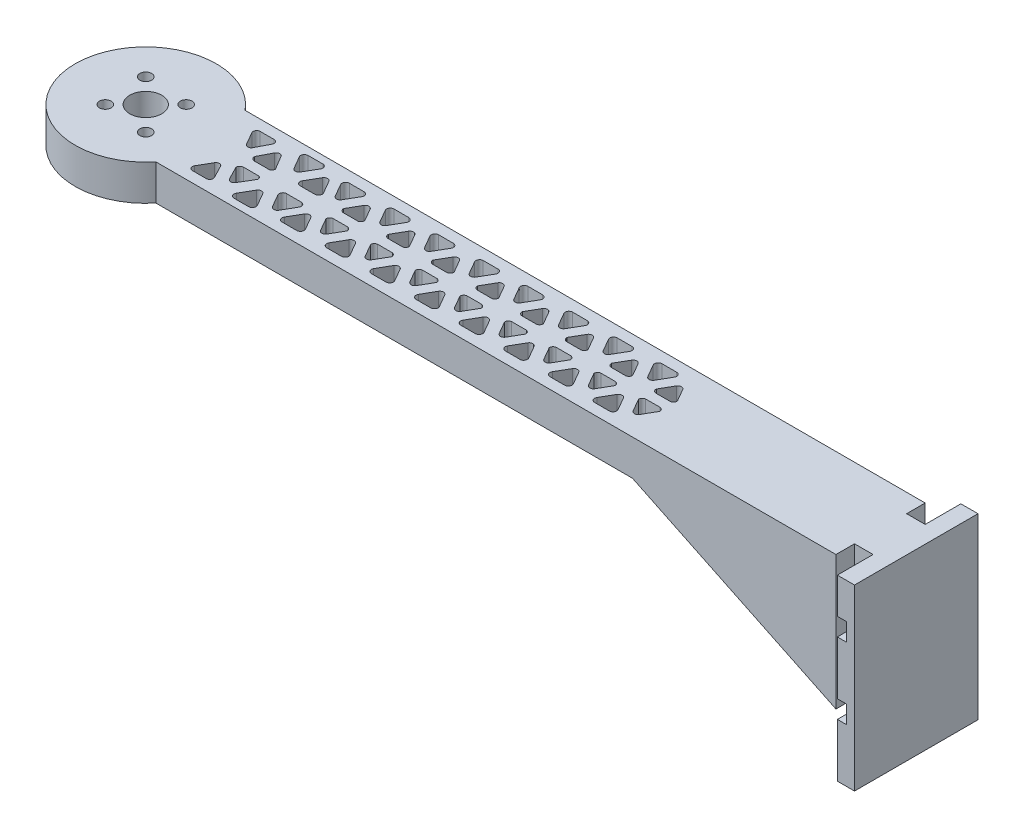
from build123d import *

# Parameters (mm, degrees)
SKETCH1_R           = 1.65
SKETCH1_R_2         = 4.5
BOSS_EXTRUDE1_DEPTH = 10
BOSS_EXTRUDE2_DEPTH = 50
BOSS_EXTRUDE3_DEPTH = 25
CUT_EXTRUDE1_REACH  = 224.387
SKETCH2_4_W         = 5.2
SKETCH2_4_H         = 5.2
CUT_EXTRUDE2_REACH  = 224.568
SKETCH4_W           = 2.5
SKETCH4_H           = 5
SKETCH4_W_2         = 0.1


with BuildPart() as part:
    # Sketch1 → Boss-Extrude1 (new body)
    with BuildSketch(Plane(origin=(0, 0, 0), x_dir=(1, 0, 0), z_dir=(0, 1, 0))):
        with BuildLine():
            Line((215.781228136, 12.419661208), (15.251683783, 12.419661208))
            ThreePointArc((15.251683783, 12.419661208), (-19.862171776, -0.080338792), (15.251683783, -12.580338792))
            Line((15.251683783, -12.580338792), (215.781228136, -12.580338792))
            Line((215.781228136, -12.580338792), (215.781228136, 12.419661208))
        make_face()
        with BuildLine():
            ThreePointArc((40.028484267, -8.923117966), (40.028697604, -9.947176998), (39.141872006, -10.459268109))
            Line((39.141872006, -10.459268109), (35.007344818, -10.459268109))
            ThreePointArc((35.007344818, -10.459268109), (34.12051922, -9.947176998), (34.120732557, -8.923117966))
            Line((34.120732557, -8.923117966), (36.187996151, -5.34480815))
            ThreePointArc((36.187996151, -5.34480815), (37.074608412, -4.833086491), (37.961220673, -5.34480815))
            Line((37.961220673, -5.34480815), (40.028484267, -8.923117966))
        make_face(mode=Mode.SUBTRACT)
        with BuildLine():
            Line((21.614703637, -8.12452744), (23.681967231, -4.546217624))
            ThreePointArc((23.681967231, -4.546217624), (24.543612682, -4.061494427), (25.383043849, -4.583744154))
            Line((25.383043849, -4.583744154), (27.244871966, -8.162053969))
            ThreePointArc((27.244871966, -8.162053969), (27.213581729, -9.113447541), (26.384038862, -9.580338792))
            Line((26.384038862, -9.580338792), (22.454947151, -9.580338792))
            ThreePointArc((22.454947151, -9.580338792), (21.614501458, -9.095029425), (21.614703637, -8.12452744))
        make_face(mode=Mode.SUBTRACT)
        with BuildLine():
            ThreePointArc((27.803132488, -2.735420106), (28.041756396, -1.959117555), (28.760166912, -1.580338792))
            Line((28.760166912, -1.580338792), (33.170984506, -1.580338792))
            ThreePointArc((33.170984506, -1.580338792), (33.622927159, -1.975727629), (33.775469807, -2.556516089))
            Line((33.775469807, -2.556516089), (31.573625479, -6.255367121))
            ThreePointArc((31.573625479, -6.255367121), (30.697555502, -6.931576396), (29.718236674, -6.416122982))
            Line((29.718236674, -6.416122982), (27.803132488, -2.735420106))
        make_face(mode=Mode.SUBTRACT)
        with BuildLine():
            Line((46.634703637, -7.963849857), (48.701967231, -4.385540041))
            ThreePointArc((48.701967231, -4.385540041), (49.588579492, -3.873818381), (50.475191753, -4.385540041))
            Line((50.475191753, -4.385540041), (52.542455347, -7.963849857))
            ThreePointArc((52.542455347, -7.963849857), (52.542668684, -8.987908889), (51.655843086, -9.5))
            Line((51.655843086, -9.5), (47.521315898, -9.5))
            ThreePointArc((47.521315898, -9.5), (46.6344903, -8.987908889), (46.634703637, -7.963849857))
        make_face(mode=Mode.SUBTRACT)
        with BuildLine():
            Line((59.144703637, -7.963849857), (61.211967231, -4.385540041))
            ThreePointArc((61.211967231, -4.385540041), (62.098579492, -3.873818381), (62.985191753, -4.385540041))
            Line((62.985191753, -4.385540041), (65.052455347, -7.963849857))
            ThreePointArc((65.052455347, -7.963849857), (65.052668684, -8.987908889), (64.165843086, -9.5))
            Line((64.165843086, -9.5), (60.031315898, -9.5))
            ThreePointArc((60.031315898, -9.5), (59.1444903, -8.987908889), (59.144703637, -7.963849857))
        make_face(mode=Mode.SUBTRACT)
        with BuildLine():
            Line((71.654703637, -7.963849857), (73.721967231, -4.385540041))
            ThreePointArc((73.721967231, -4.385540041), (74.608579492, -3.873818381), (75.495191753, -4.385540041))
            Line((75.495191753, -4.385540041), (77.562455347, -7.963849857))
            ThreePointArc((77.562455347, -7.963849857), (77.562668684, -8.987908889), (76.675843086, -9.5))
            Line((76.675843086, -9.5), (72.541315898, -9.5))
            ThreePointArc((72.541315898, -9.5), (71.6544903, -8.987908889), (71.654703637, -7.963849857))
        make_face(mode=Mode.SUBTRACT)
        with BuildLine():
            Line((84.164703637, -7.963849857), (86.231967231, -4.385540041))
            ThreePointArc((86.231967231, -4.385540041), (87.118579492, -3.873818381), (88.005191753, -4.385540041))
            Line((88.005191753, -4.385540041), (90.072455347, -7.963849857))
            ThreePointArc((90.072455347, -7.963849857), (90.072668684, -8.987908889), (89.185843086, -9.5))
            Line((89.185843086, -9.5), (85.051315898, -9.5))
            ThreePointArc((85.051315898, -9.5), (84.1644903, -8.987908889), (84.164703637, -7.963849857))
        make_face(mode=Mode.SUBTRACT)
        with BuildLine():
            Line((46.281498727, -3.523632181), (44.214235133, -7.101941997))
            ThreePointArc((44.214235133, -7.101941997), (43.327622872, -7.613663657), (42.441010611, -7.101941997))
            Line((42.441010611, -7.101941997), (40.373261673, -3.514943175))
            ThreePointArc((40.373261673, -3.514943175), (40.373776477, -2.491304726), (41.260359278, -1.979634055))
            Line((41.260359278, -1.979634055), (45.394886466, -1.979634055))
            ThreePointArc((45.394886466, -1.979634055), (46.287424275, -2.493670166), (46.281498727, -3.523632181))
        make_face(mode=Mode.SUBTRACT)
        with BuildLine():
            ThreePointArc((52.887718097, -2.564364072), (53.123716588, -1.859495358), (53.774330358, -1.5))
            Line((53.774330358, -1.5), (57.908857546, -1.5))
            ThreePointArc((57.908857546, -1.5), (58.556731527, -1.85658781), (58.795469807, -2.556516089))
            Line((58.795469807, -2.556516089), (56.728206213, -6.142673887))
            ThreePointArc((56.728206213, -6.142673887), (55.841593952, -6.654395547), (54.954981691, -6.142673887))
            Line((54.954981691, -6.142673887), (52.887718097, -2.564364072))
        make_face(mode=Mode.SUBTRACT)
        with BuildLine():
            ThreePointArc((65.397718097, -2.564364072), (65.633716588, -1.859495358), (66.284330358, -1.5))
            Line((66.284330358, -1.5), (70.418857546, -1.5))
            ThreePointArc((70.418857546, -1.5), (71.066731527, -1.85658781), (71.305469807, -2.556516089))
            Line((71.305469807, -2.556516089), (69.238206213, -6.142673887))
            ThreePointArc((69.238206213, -6.142673887), (68.351593952, -6.654395547), (67.464981691, -6.142673887))
            Line((67.464981691, -6.142673887), (65.397718097, -2.564364072))
        make_face(mode=Mode.SUBTRACT)
        with BuildLine():
            ThreePointArc((77.907718097, -2.564364072), (78.143716588, -1.859495358), (78.794330358, -1.5))
            Line((78.794330358, -1.5), (82.928857546, -1.5))
            ThreePointArc((82.928857546, -1.5), (83.576731527, -1.85658781), (83.815469807, -2.556516089))
            Line((83.815469807, -2.556516089), (81.748206213, -6.142673887))
            ThreePointArc((81.748206213, -6.142673887), (80.861593952, -6.654395547), (79.974981691, -6.142673887))
            Line((79.974981691, -6.142673887), (77.907718097, -2.564364072))
        make_face(mode=Mode.SUBTRACT)
        with BuildLine():
            ThreePointArc((90.417718097, -2.564364072), (90.653716588, -1.859495358), (91.304330358, -1.5))
            Line((91.304330358, -1.5), (95.438857546, -1.5))
            ThreePointArc((95.438857546, -1.5), (96.086731527, -1.85658781), (96.325469807, -2.556516089))
            Line((96.325469807, -2.556516089), (94.258206213, -6.142673887))
            ThreePointArc((94.258206213, -6.142673887), (93.371593952, -6.654395547), (92.484981691, -6.142673887))
            Line((92.484981691, -6.142673887), (90.417718097, -2.564364072))
        make_face(mode=Mode.SUBTRACT)
        with BuildLine():
            Line((96.674703637, -7.963849857), (98.741967231, -4.385540041))
            ThreePointArc((98.741967231, -4.385540041), (99.628579492, -3.873818381), (100.515191753, -4.385540041))
            Line((100.515191753, -4.385540041), (102.582455347, -7.963849857))
            ThreePointArc((102.582455347, -7.963849857), (102.582668684, -8.987908889), (101.695843086, -9.5))
            Line((101.695843086, -9.5), (97.561315898, -9.5))
            ThreePointArc((97.561315898, -9.5), (96.6744903, -8.987908889), (96.674703637, -7.963849857))
        make_face(mode=Mode.SUBTRACT)
        with BuildLine():
            Line((109.184703637, -7.963849857), (111.251967231, -4.385540041))
            ThreePointArc((111.251967231, -4.385540041), (112.138579492, -3.873818381), (113.025191753, -4.385540041))
            Line((113.025191753, -4.385540041), (115.092455347, -7.963849857))
            ThreePointArc((115.092455347, -7.963849857), (115.092668684, -8.987908889), (114.205843086, -9.5))
            Line((114.205843086, -9.5), (110.071315898, -9.5))
            ThreePointArc((110.071315898, -9.5), (109.1844903, -8.987908889), (109.184703637, -7.963849857))
        make_face(mode=Mode.SUBTRACT)
        with BuildLine():
            Line((121.694703637, -7.963849857), (123.761967231, -4.385540041))
            ThreePointArc((123.761967231, -4.385540041), (124.648579492, -3.873818381), (125.535191753, -4.385540041))
            Line((125.535191753, -4.385540041), (127.602455347, -7.963849857))
            ThreePointArc((127.602455347, -7.963849857), (127.602668684, -8.987908889), (126.715843086, -9.5))
            Line((126.715843086, -9.5), (122.581315898, -9.5))
            ThreePointArc((122.581315898, -9.5), (121.6944903, -8.987908889), (121.694703637, -7.963849857))
        make_face(mode=Mode.SUBTRACT)
        with BuildLine():
            Line((134.204703637, -7.963849857), (136.271967231, -4.385540041))
            ThreePointArc((136.271967231, -4.385540041), (137.158579492, -3.873818381), (138.045191753, -4.385540041))
            Line((138.045191753, -4.385540041), (140.112455347, -7.963849857))
            ThreePointArc((140.112455347, -7.963849857), (140.112668684, -8.987908889), (139.225843086, -9.5))
            Line((139.225843086, -9.5), (135.091315898, -9.5))
            ThreePointArc((135.091315898, -9.5), (134.2044903, -8.987908889), (134.204703637, -7.963849857))
        make_face(mode=Mode.SUBTRACT)
        with BuildLine():
            ThreePointArc((102.927718097, -2.564364072), (103.163716588, -1.859495358), (103.814330358, -1.5))
            Line((103.814330358, -1.5), (107.948857546, -1.5))
            ThreePointArc((107.948857546, -1.5), (108.596731527, -1.85658781), (108.835469807, -2.556516089))
            Line((108.835469807, -2.556516089), (106.768206213, -6.142673887))
            ThreePointArc((106.768206213, -6.142673887), (105.881593952, -6.654395547), (104.994981691, -6.142673887))
            Line((104.994981691, -6.142673887), (102.927718097, -2.564364072))
        make_face(mode=Mode.SUBTRACT)
        with BuildLine():
            ThreePointArc((115.437718097, -2.564364072), (115.673716588, -1.859495358), (116.324330358, -1.5))
            Line((116.324330358, -1.5), (120.458857546, -1.5))
            ThreePointArc((120.458857546, -1.5), (121.106731527, -1.85658781), (121.345469807, -2.556516089))
            Line((121.345469807, -2.556516089), (119.278206213, -6.142673887))
            ThreePointArc((119.278206213, -6.142673887), (118.391593952, -6.654395547), (117.504981691, -6.142673887))
            Line((117.504981691, -6.142673887), (115.437718097, -2.564364072))
        make_face(mode=Mode.SUBTRACT)
        with BuildLine():
            ThreePointArc((127.947718097, -2.564364072), (128.183716588, -1.859495358), (128.834330358, -1.5))
            Line((128.834330358, -1.5), (132.968857546, -1.5))
            ThreePointArc((132.968857546, -1.5), (133.616731527, -1.85658781), (133.855469807, -2.556516089))
            Line((133.855469807, -2.556516089), (131.788206213, -6.142673887))
            ThreePointArc((131.788206213, -6.142673887), (130.901593952, -6.654395547), (130.014981691, -6.142673887))
            Line((130.014981691, -6.142673887), (127.947718097, -2.564364072))
        make_face(mode=Mode.SUBTRACT)
        with BuildLine():
            ThreePointArc((140.457718097, -2.564364072), (140.693716588, -1.859495358), (141.344330358, -1.5))
            Line((141.344330358, -1.5), (145.478857546, -1.5))
            ThreePointArc((145.478857546, -1.5), (146.126731527, -1.85658781), (146.365469807, -2.556516089))
            Line((146.365469807, -2.556516089), (144.298206213, -6.142673887))
            ThreePointArc((144.298206213, -6.142673887), (143.411593952, -6.654395547), (142.524981691, -6.142673887))
            Line((142.524981691, -6.142673887), (140.457718097, -2.564364072))
        make_face(mode=Mode.SUBTRACT)
        with BuildLine():
            Line((27.803132488, 2.574742523), (29.718236674, 6.255445399))
            ThreePointArc((29.718236674, 6.255445399), (30.697555502, 6.770898813), (31.573625479, 6.094689538))
            Line((31.573625479, 6.094689538), (33.775469807, 2.395838506))
            ThreePointArc((33.775469807, 2.395838506), (33.622927159, 1.815050046), (33.170984506, 1.419661208))
            Line((33.170984506, 1.419661208), (28.760166912, 1.419661208))
            ThreePointArc((28.760166912, 1.419661208), (28.041756396, 1.798439972), (27.803132488, 2.574742523))
        make_face(mode=Mode.SUBTRACT)
        with BuildLine():
            ThreePointArc((21.614703637, 7.963849857), (21.614501458, 8.934351842), (22.454947151, 9.419661208))
            Line((22.454947151, 9.419661208), (26.384038862, 9.419661208))
            ThreePointArc((26.384038862, 9.419661208), (27.213581729, 8.952769958), (27.244871966, 8.001376386))
            Line((27.244871966, 8.001376386), (25.383043849, 4.423066571))
            ThreePointArc((25.383043849, 4.423066571), (24.543612682, 3.900816844), (23.681967231, 4.385540041))
            Line((23.681967231, 4.385540041), (21.614703637, 7.963849857))
        make_face(mode=Mode.SUBTRACT)
        with BuildLine():
            Line((40.028484267, 8.762440383), (37.961220673, 5.184130567))
            ThreePointArc((37.961220673, 5.184130567), (37.074608412, 4.672408908), (36.187996151, 5.184130567))
            Line((36.187996151, 5.184130567), (34.120732557, 8.762440383))
            ThreePointArc((34.120732557, 8.762440383), (34.12051922, 9.786499415), (35.007344818, 10.298590526))
            Line((35.007344818, 10.298590526), (39.141872006, 10.298590526))
            ThreePointArc((39.141872006, 10.298590526), (40.028697604, 9.786499415), (40.028484267, 8.762440383))
        make_face(mode=Mode.SUBTRACT)
        with BuildLine():
            ThreePointArc((46.281498727, 3.362954598), (46.287424275, 2.332992583), (45.394886466, 1.818956472))
            Line((45.394886466, 1.818956472), (41.260359278, 1.818956472))
            ThreePointArc((41.260359278, 1.818956472), (40.373776477, 2.330627143), (40.373261673, 3.354265592))
            Line((40.373261673, 3.354265592), (42.441010611, 6.941264414))
            ThreePointArc((42.441010611, 6.941264414), (43.327622872, 7.452986074), (44.214235133, 6.941264414))
            Line((44.214235133, 6.941264414), (46.281498727, 3.362954598))
        make_face(mode=Mode.SUBTRACT)
        with BuildLine():
            Line((52.887718097, 2.403686489), (54.954981691, 5.981996304))
            ThreePointArc((54.954981691, 5.981996304), (55.841593952, 6.493717964), (56.728206213, 5.981996304))
            Line((56.728206213, 5.981996304), (58.795469807, 2.395838506))
            ThreePointArc((58.795469807, 2.395838506), (58.556731527, 1.695910227), (57.908857546, 1.339322417))
            Line((57.908857546, 1.339322417), (53.774330358, 1.339322417))
            ThreePointArc((53.774330358, 1.339322417), (53.123716588, 1.698817775), (52.887718097, 2.403686489))
        make_face(mode=Mode.SUBTRACT)
        with BuildLine():
            Line((65.397718097, 2.403686489), (67.464981691, 5.981996304))
            ThreePointArc((67.464981691, 5.981996304), (68.351593952, 6.493717964), (69.238206213, 5.981996304))
            Line((69.238206213, 5.981996304), (71.305469807, 2.395838506))
            ThreePointArc((71.305469807, 2.395838506), (71.066731527, 1.695910227), (70.418857546, 1.339322417))
            Line((70.418857546, 1.339322417), (66.284330358, 1.339322417))
            ThreePointArc((66.284330358, 1.339322417), (65.633716588, 1.698817775), (65.397718097, 2.403686489))
        make_face(mode=Mode.SUBTRACT)
        with BuildLine():
            Line((77.907718097, 2.403686489), (79.974981691, 5.981996304))
            ThreePointArc((79.974981691, 5.981996304), (80.861593952, 6.493717964), (81.748206213, 5.981996304))
            Line((81.748206213, 5.981996304), (83.815469807, 2.395838506))
            ThreePointArc((83.815469807, 2.395838506), (83.576731527, 1.695910227), (82.928857546, 1.339322417))
            Line((82.928857546, 1.339322417), (78.794330358, 1.339322417))
            ThreePointArc((78.794330358, 1.339322417), (78.143716588, 1.698817775), (77.907718097, 2.403686489))
        make_face(mode=Mode.SUBTRACT)
        with BuildLine():
            Line((90.417718097, 2.403686489), (92.484981691, 5.981996304))
            ThreePointArc((92.484981691, 5.981996304), (93.371593952, 6.493717964), (94.258206213, 5.981996304))
            Line((94.258206213, 5.981996304), (96.325469807, 2.395838506))
            ThreePointArc((96.325469807, 2.395838506), (96.086731527, 1.695910227), (95.438857546, 1.339322417))
            Line((95.438857546, 1.339322417), (91.304330358, 1.339322417))
            ThreePointArc((91.304330358, 1.339322417), (90.653716588, 1.698817775), (90.417718097, 2.403686489))
        make_face(mode=Mode.SUBTRACT)
        with BuildLine():
            ThreePointArc((46.634703637, 7.803172274), (46.6344903, 8.827231306), (47.521315898, 9.339322417))
            Line((47.521315898, 9.339322417), (51.655843086, 9.339322417))
            ThreePointArc((51.655843086, 9.339322417), (52.542668684, 8.827231306), (52.542455347, 7.803172274))
            Line((52.542455347, 7.803172274), (50.475191753, 4.224862458))
            ThreePointArc((50.475191753, 4.224862458), (49.588579492, 3.713140798), (48.701967231, 4.224862458))
            Line((48.701967231, 4.224862458), (46.634703637, 7.803172274))
        make_face(mode=Mode.SUBTRACT)
        with BuildLine():
            ThreePointArc((59.144703637, 7.803172274), (59.1444903, 8.827231306), (60.031315898, 9.339322417))
            Line((60.031315898, 9.339322417), (64.165843086, 9.339322417))
            ThreePointArc((64.165843086, 9.339322417), (65.052668684, 8.827231306), (65.052455347, 7.803172274))
            Line((65.052455347, 7.803172274), (62.985191753, 4.224862458))
            ThreePointArc((62.985191753, 4.224862458), (62.098579492, 3.713140798), (61.211967231, 4.224862458))
            Line((61.211967231, 4.224862458), (59.144703637, 7.803172274))
        make_face(mode=Mode.SUBTRACT)
        with BuildLine():
            ThreePointArc((71.654703637, 7.803172274), (71.6544903, 8.827231306), (72.541315898, 9.339322417))
            Line((72.541315898, 9.339322417), (76.675843086, 9.339322417))
            ThreePointArc((76.675843086, 9.339322417), (77.562668684, 8.827231306), (77.562455347, 7.803172274))
            Line((77.562455347, 7.803172274), (75.495191753, 4.224862458))
            ThreePointArc((75.495191753, 4.224862458), (74.608579492, 3.713140798), (73.721967231, 4.224862458))
            Line((73.721967231, 4.224862458), (71.654703637, 7.803172274))
        make_face(mode=Mode.SUBTRACT)
        with BuildLine():
            ThreePointArc((84.164703637, 7.803172274), (84.1644903, 8.827231306), (85.051315898, 9.339322417))
            Line((85.051315898, 9.339322417), (89.185843086, 9.339322417))
            ThreePointArc((89.185843086, 9.339322417), (90.072668684, 8.827231306), (90.072455347, 7.803172274))
            Line((90.072455347, 7.803172274), (88.005191753, 4.224862458))
            ThreePointArc((88.005191753, 4.224862458), (87.118579492, 3.713140798), (86.231967231, 4.224862458))
            Line((86.231967231, 4.224862458), (84.164703637, 7.803172274))
        make_face(mode=Mode.SUBTRACT)
        with BuildLine():
            Line((102.927718097, 2.403686489), (104.994981691, 5.981996304))
            ThreePointArc((104.994981691, 5.981996304), (105.881593952, 6.493717964), (106.768206213, 5.981996304))
            Line((106.768206213, 5.981996304), (108.835469807, 2.395838506))
            ThreePointArc((108.835469807, 2.395838506), (108.596731527, 1.695910227), (107.948857546, 1.339322417))
            Line((107.948857546, 1.339322417), (103.814330358, 1.339322417))
            ThreePointArc((103.814330358, 1.339322417), (103.163716588, 1.698817775), (102.927718097, 2.403686489))
        make_face(mode=Mode.SUBTRACT)
        with BuildLine():
            Line((115.437718097, 2.403686489), (117.504981691, 5.981996304))
            ThreePointArc((117.504981691, 5.981996304), (118.391593952, 6.493717964), (119.278206213, 5.981996304))
            Line((119.278206213, 5.981996304), (121.345469807, 2.395838506))
            ThreePointArc((121.345469807, 2.395838506), (121.106731527, 1.695910227), (120.458857546, 1.339322417))
            Line((120.458857546, 1.339322417), (116.324330358, 1.339322417))
            ThreePointArc((116.324330358, 1.339322417), (115.673716588, 1.698817775), (115.437718097, 2.403686489))
        make_face(mode=Mode.SUBTRACT)
        with BuildLine():
            Line((127.947718097, 2.403686489), (130.014981691, 5.981996304))
            ThreePointArc((130.014981691, 5.981996304), (130.901593952, 6.493717964), (131.788206213, 5.981996304))
            Line((131.788206213, 5.981996304), (133.855469807, 2.395838506))
            ThreePointArc((133.855469807, 2.395838506), (133.616731527, 1.695910227), (132.968857546, 1.339322417))
            Line((132.968857546, 1.339322417), (128.834330358, 1.339322417))
            ThreePointArc((128.834330358, 1.339322417), (128.183716588, 1.698817775), (127.947718097, 2.403686489))
        make_face(mode=Mode.SUBTRACT)
        with BuildLine():
            Line((140.457718097, 2.403686489), (142.524981691, 5.981996304))
            ThreePointArc((142.524981691, 5.981996304), (143.411593952, 6.493717964), (144.298206213, 5.981996304))
            Line((144.298206213, 5.981996304), (146.365469807, 2.395838506))
            ThreePointArc((146.365469807, 2.395838506), (146.126731527, 1.695910227), (145.478857546, 1.339322417))
            Line((145.478857546, 1.339322417), (141.344330358, 1.339322417))
            ThreePointArc((141.344330358, 1.339322417), (140.693716588, 1.698817775), (140.457718097, 2.403686489))
        make_face(mode=Mode.SUBTRACT)
        with BuildLine():
            ThreePointArc((96.674703637, 7.803172274), (96.6744903, 8.827231306), (97.561315898, 9.339322417))
            Line((97.561315898, 9.339322417), (101.695843086, 9.339322417))
            ThreePointArc((101.695843086, 9.339322417), (102.582668684, 8.827231306), (102.582455347, 7.803172274))
            Line((102.582455347, 7.803172274), (100.515191753, 4.224862458))
            ThreePointArc((100.515191753, 4.224862458), (99.628579492, 3.713140798), (98.741967231, 4.224862458))
            Line((98.741967231, 4.224862458), (96.674703637, 7.803172274))
        make_face(mode=Mode.SUBTRACT)
        with BuildLine():
            ThreePointArc((109.184703637, 7.803172274), (109.1844903, 8.827231306), (110.071315898, 9.339322417))
            Line((110.071315898, 9.339322417), (114.205843086, 9.339322417))
            ThreePointArc((114.205843086, 9.339322417), (115.092668684, 8.827231306), (115.092455347, 7.803172274))
            Line((115.092455347, 7.803172274), (113.025191753, 4.224862458))
            ThreePointArc((113.025191753, 4.224862458), (112.138579492, 3.713140798), (111.251967231, 4.224862458))
            Line((111.251967231, 4.224862458), (109.184703637, 7.803172274))
        make_face(mode=Mode.SUBTRACT)
        with BuildLine():
            ThreePointArc((121.694703637, 7.803172274), (121.6944903, 8.827231306), (122.581315898, 9.339322417))
            Line((122.581315898, 9.339322417), (126.715843086, 9.339322417))
            ThreePointArc((126.715843086, 9.339322417), (127.602668684, 8.827231306), (127.602455347, 7.803172274))
            Line((127.602455347, 7.803172274), (125.535191753, 4.224862458))
            ThreePointArc((125.535191753, 4.224862458), (124.648579492, 3.713140798), (123.761967231, 4.224862458))
            Line((123.761967231, 4.224862458), (121.694703637, 7.803172274))
        make_face(mode=Mode.SUBTRACT)
        with BuildLine():
            ThreePointArc((134.204703637, 7.803172274), (134.2044903, 8.827231306), (135.091315898, 9.339322417))
            Line((135.091315898, 9.339322417), (139.225843086, 9.339322417))
            ThreePointArc((139.225843086, 9.339322417), (140.112668684, 8.827231306), (140.112455347, 7.803172274))
            Line((140.112455347, 7.803172274), (138.045191753, 4.224862458))
            ThreePointArc((138.045191753, 4.224862458), (137.158579492, 3.713140798), (136.271967231, 4.224862458))
            Line((136.271967231, 4.224862458), (134.204703637, 7.803172274))
        make_face(mode=Mode.SUBTRACT)
        with Locations(Location((-6.797853213, 6.63717563, 0), (0, 0, 270))):
            Circle(SKETCH1_R, mode=Mode.SUBTRACT)
        with Locations(Location((5.576515458, 5.576515458, 0), (0, 0, 270))):
            Circle(SKETCH1_R, mode=Mode.SUBTRACT)
        with Locations(Location((-5.737193041, -5.737193041, 0), (0, 0, 270))):
            Circle(SKETCH1_R, mode=Mode.SUBTRACT)
        with Locations(Location((6.63717563, -6.797853213, 0), (0, 0, 270))):
            Circle(SKETCH1_R, mode=Mode.SUBTRACT)
        with Locations(Location((-0.080338792, -0.080338792, 0), (0, 0, 270))):
            Circle(SKETCH1_R_2, mode=Mode.SUBTRACT)
    extrude(amount=BOSS_EXTRUDE1_DEPTH)

    # Sketch2 → Boss-Extrude2 (add)
    with BuildSketch(Plane(origin=(0, 10, 0), x_dir=(1, 0, 0), z_dir=(0, 1, 0))):
        Polygon((215.781228136, -17.380338792), (215.781228136, -12.580338792), (215.781228136, 12.419661208), (215.781228136, 17.219661208), (210.981228136, 17.219661208), (210.981228136, -12.580338792), (210.981228136, -17.380338792), align=None)
    extrude(amount=-BOSS_EXTRUDE2_DEPTH)

    # Sketch3 → Boss-Extrude3 (add)
    with BuildSketch(Plane.XY.offset(12.580338792)):
        Polygon((210.981228136, 0), (148.781228136, 0), (210.981228136, -30), align=None)
    extrude(amount=-BOSS_EXTRUDE3_DEPTH)

    # Cut-Extrude1: up to this plane
    cut_extrude1_end = Plane(origin=(210.981228136, -30, -81.476449434), z_dir=(-0.4344250691489581, -0.9007079767021735, 0))
    # Sketch2<4> → Cut-Extrude1 (cut, up to the surface)
    with BuildSketch(Plane(origin=(0, 10, 0), x_dir=(1, 0, 0), z_dir=(0, 1, 0)), mode=Mode.PRIVATE) as cut_extrude1_sk1:
        with Locations((208.381228136, 9.819661208)):
            Rectangle(SKETCH2_4_W, SKETCH2_4_H)
    cut_extrude1_tool1 = split(extrude(cut_extrude1_sk1.sketch, amount=-CUT_EXTRUDE1_REACH, mode=Mode.PRIVATE), bisect_by=cut_extrude1_end, keep=Keep.BOTH, mode=Mode.PRIVATE)
    add(cut_extrude1_tool1.solids().sort_by_distance((208.381228, 10, -9.819661))[0], mode=Mode.SUBTRACT)
    # Sketch2<4> → Cut-Extrude1 (cut, up to the surface)
    with BuildSketch(Plane(origin=(0, 10, 0), x_dir=(1, 0, 0), z_dir=(0, 1, 0)), mode=Mode.PRIVATE) as cut_extrude1_sk2:
        with Locations((208.381228136, -9.980338792)):
            Rectangle(SKETCH2_4_W, SKETCH2_4_H)
    cut_extrude1_tool2 = split(extrude(cut_extrude1_sk2.sketch, amount=-CUT_EXTRUDE1_REACH, mode=Mode.PRIVATE), bisect_by=cut_extrude1_end, keep=Keep.BOTH, mode=Mode.PRIVATE)
    add(cut_extrude1_tool2.solids().sort_by_distance((208.381228, 10, 9.980339))[0], mode=Mode.SUBTRACT)

    # Cut-Extrude2: up to this face of the body (flat: up to its plane)
    cut_extrude2_end = Plane(part.part.faces().sort_by_distance((213.381228136, -15, -17.219661208))[0])
    # Sketch4 → Cut-Extrude2 (cut, up to the picked face)
    with BuildSketch(Plane.XY.offset(17.380338792), mode=Mode.PRIVATE) as cut_extrude2_sk1:
        with Locations((209.731228136, -22.5)):
            Rectangle(SKETCH4_W, SKETCH4_H)
    cut_extrude2_tool1 = split(extrude(cut_extrude2_sk1.sketch, amount=-CUT_EXTRUDE2_REACH, mode=Mode.PRIVATE), bisect_by=cut_extrude2_end, keep=Keep.BOTH, mode=Mode.PRIVATE)
    # Sketch4 → Cut-Extrude2 (cut, up to the picked face)
    with BuildSketch(Plane.XY.offset(17.380338792), mode=Mode.PRIVATE) as cut_extrude2_sk2:
        with Locations((212.231228136, -22.5)):
            Rectangle(SKETCH4_W, SKETCH4_H)
    cut_extrude2_tool2 = split(extrude(cut_extrude2_sk2.sketch, amount=-CUT_EXTRUDE2_REACH, mode=Mode.PRIVATE), bisect_by=cut_extrude2_end, keep=Keep.BOTH, mode=Mode.PRIVATE)
    # Sketch4 → Cut-Extrude2 (cut, up to the picked face)
    with BuildSketch(Plane.XY.offset(17.380338792), mode=Mode.PRIVATE) as cut_extrude2_sk3:
        with Locations((209.731228136, -2.5)):
            Rectangle(SKETCH4_W, SKETCH4_H)
    cut_extrude2_tool3 = split(extrude(cut_extrude2_sk3.sketch, amount=-CUT_EXTRUDE2_REACH, mode=Mode.PRIVATE), bisect_by=cut_extrude2_end, keep=Keep.BOTH, mode=Mode.PRIVATE)
    # Sketch4 → Cut-Extrude2 (cut, up to the picked face)
    with BuildSketch(Plane.XY.offset(17.380338792), mode=Mode.PRIVATE) as cut_extrude2_sk4:
        with Locations((212.231228136, -2.5)):
            Rectangle(SKETCH4_W, SKETCH4_H)
    cut_extrude2_tool4 = split(extrude(cut_extrude2_sk4.sketch, amount=-CUT_EXTRUDE2_REACH, mode=Mode.PRIVATE), bisect_by=cut_extrude2_end, keep=Keep.BOTH, mode=Mode.PRIVATE)
    # Sketch4 → Cut-Extrude2 (cut, up to the picked face)
    with BuildSketch(Plane.XY.offset(17.380338792), mode=Mode.PRIVATE) as cut_extrude2_sk5:
        with Locations((208.431228136, -22.5)):
            Rectangle(SKETCH4_W_2, SKETCH4_H)
    cut_extrude2_tool5 = split(extrude(cut_extrude2_sk5.sketch, amount=-CUT_EXTRUDE2_REACH, mode=Mode.PRIVATE), bisect_by=cut_extrude2_end, keep=Keep.BOTH, mode=Mode.PRIVATE)
    # Sketch4 → Cut-Extrude2 (cut, up to the picked face)
    with BuildSketch(Plane.XY.offset(17.380338792), mode=Mode.PRIVATE) as cut_extrude2_sk6:
        with Locations((208.431228136, -2.5)):
            Rectangle(SKETCH4_W_2, SKETCH4_H)
    cut_extrude2_tool6 = split(extrude(cut_extrude2_sk6.sketch, amount=-CUT_EXTRUDE2_REACH, mode=Mode.PRIVATE), bisect_by=cut_extrude2_end, keep=Keep.BOTH, mode=Mode.PRIVATE)
    add(cut_extrude2_tool1.solids().sort_by(Axis((209.731228, -22.5, 17.380339), (0, 0, -1)))[0], mode=Mode.SUBTRACT)
    add(cut_extrude2_tool2.solids().sort_by(Axis((212.231228, -22.5, 17.380339), (0, 0, -1)))[0], mode=Mode.SUBTRACT)
    add(cut_extrude2_tool3.solids().sort_by(Axis((209.731228, -2.5, 17.380339), (0, 0, -1)))[0], mode=Mode.SUBTRACT)
    add(cut_extrude2_tool4.solids().sort_by(Axis((212.231228, -2.5, 17.380339), (0, 0, -1)))[0], mode=Mode.SUBTRACT)
    add(cut_extrude2_tool5.solids().sort_by(Axis((208.431228, -22.5, 17.380339), (0, 0, -1)))[0], mode=Mode.SUBTRACT)
    add(cut_extrude2_tool6.solids().sort_by(Axis((208.431228, -2.5, 17.380339), (0, 0, -1)))[0], mode=Mode.SUBTRACT)


solid = part.part
